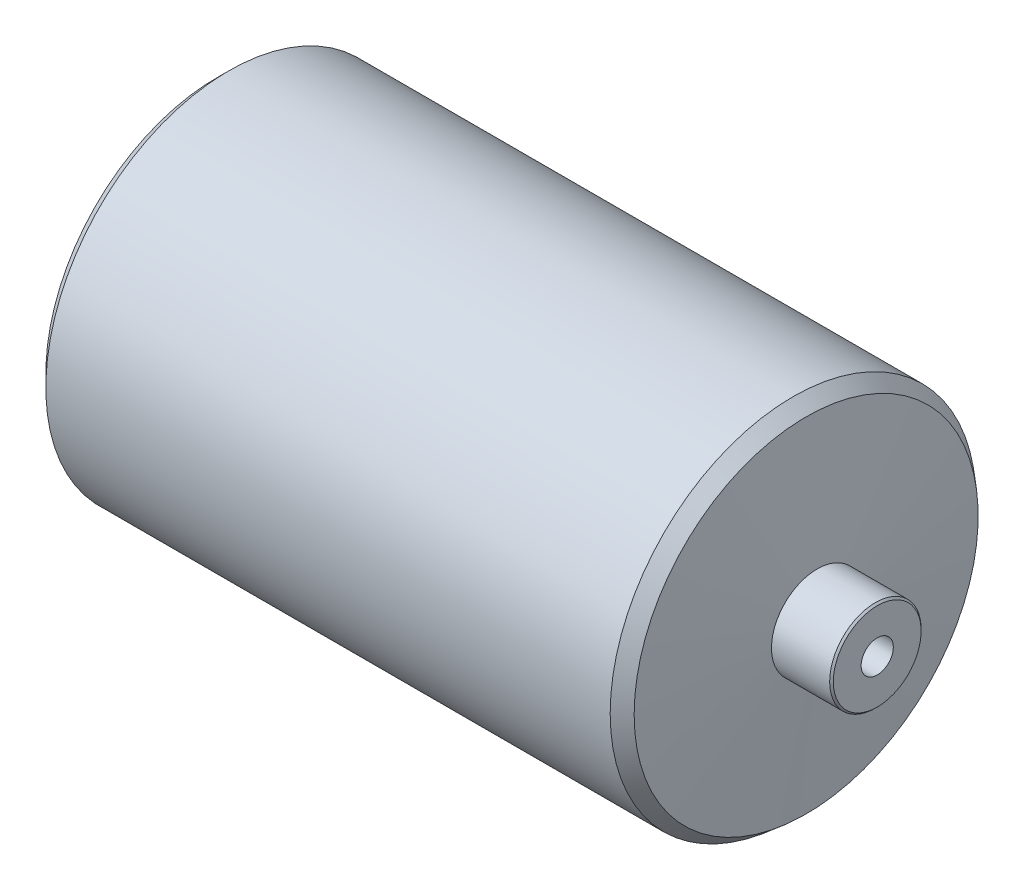
from build123d import *
from OCP.BRepFilletAPI import BRepFilletAPI_MakeChamfer

# Parameters (mm, degrees)
SKETCH_1_W       = 16.4
SKETCH_1_H       = 12.5
SKETCH_1_W_2     = 16.5
CHAMFER_1_SIZE   = 0.5
CHAMFER_2_SIZE   = 3
CHAMFER_2_SIZE2  = 3.300188603
M10X1_25_1_D     = 8.8
M10X1_25_1_DEPTH = 59
M10X1_25_1_TIP   = 2.643786724
M10X1_25_2_D     = 8.8
M10X1_25_2_DEPTH = 59
M10X1_25_2_TIP   = 2.643786724


with BuildPart() as part:
    # 草圖1 → 旋轉1 (revolve)
    with BuildSketch(Plane.XY, mode=Mode.PRIVATE) as revolve_1_sk:
        Polygon((16.5, 12.5), (16.5, 0), (183.6, 0), (183.6, 12.5), (183.6, 50), (16.5, 50), align=None)
        with Locations((191.8, 6.25)):
            Rectangle(SKETCH_1_W, SKETCH_1_H)
        with Locations((8.25, 6.25)):
            Rectangle(SKETCH_1_W_2, SKETCH_1_H)
    revolve(revolve_1_sk.sketch.rotate(Axis((16.5, 0, 0), (1, 0, 0)), 90), axis=Axis((16.5, 0, 0), (1, 0, 0)))

    # 草圖2 → 除料-旋轉1 (revolve, cut)
    with BuildSketch(Plane.XY, mode=Mode.PRIVATE) as cut_revolve_1_sk:
        Polygon((186.873055919, 74.843370729), (1.025224849, 63.173855755), (0, 12.5), (16.5, 12.5), (20.558049953, 58.883723216), (178.981866404, 65.285508546), (183.6, 12.5), (200, 12.5), align=None)
    revolve(cut_revolve_1_sk.sketch.rotate(Axis((0, 0, 0), (-1, 0, 0)), 270), axis=Axis((0, 0, 0), (-1, 0, 0)), mode=Mode.SUBTRACT)

    # 導角1
    chamfer_1_edges = [part.edges().sort_by_distance(p)[0] for p in [
        (200, 0, -12.5),
        (0, 0, -12.5),
    ]]
    chamfer(chamfer_1_edges, length=CHAMFER_1_SIZE)

    # 導角2: one chamfer whose edges measure the first distance from different faces: ONE call of the kernel's chamfer builder (chamfer() names one face for all edges)
    chamfer_2_edges_1 = [part.edges().sort_by_distance(p)[0] for p in [
        (19.780824882, 0, -50),
    ]]
    chamfer_2_side_1 = [part.faces().sort_by_distance(p)[0] for p in [
        (100.05, 0, -50),
    ]]
    chamfer_2_edges_2 = [part.edges().sort_by_distance(p)[0] for p in [
        (180.319175118, 0, -50),
    ]]
    chamfer_2_side_2 = [part.faces().sort_by_distance(p)[0] for p in [
        (181.959587559, 0, -31.25),
    ]]
    chamfer_2 = BRepFilletAPI_MakeChamfer(part.part.solid().wrapped)
    for e in chamfer_2_edges_1:
        chamfer_2.Add(CHAMFER_2_SIZE, CHAMFER_2_SIZE2, e.wrapped, chamfer_2_side_1[0].wrapped)  # the first distance lies on this face
    for e in chamfer_2_edges_2:
        chamfer_2.Add(CHAMFER_2_SIZE, CHAMFER_2_SIZE2, e.wrapped, chamfer_2_side_2[0].wrapped)  # the first distance lies on this face
    add(Compound.cast(chamfer_2.Shape()), mode=Mode.REPLACE)

    # M10x1.25 螺紋孔1
    with Locations(Plane(origin=(200, 0, 0), x_dir=(0, 0, 1), z_dir=(1, 0, 0))):
        with Locations((0, 0)):
            Hole(M10X1_25_1_D / 2, depth=M10X1_25_1_DEPTH)
            with Locations((0, 0, -(M10X1_25_1_DEPTH + M10X1_25_1_TIP / 2))):  # 118° drill point
                Cone(0, M10X1_25_1_D / 2, M10X1_25_1_TIP, mode=Mode.SUBTRACT)

    # M10x1.25 螺紋孔2
    with Locations(Plane.ZY):
        with Locations((0, 0)):
            Hole(M10X1_25_2_D / 2, depth=M10X1_25_2_DEPTH)
            with Locations((0, 0, -(M10X1_25_2_DEPTH + M10X1_25_2_TIP / 2))):  # 118° drill point
                Cone(0, M10X1_25_2_D / 2, M10X1_25_2_TIP, mode=Mode.SUBTRACT)


solid = part.part
